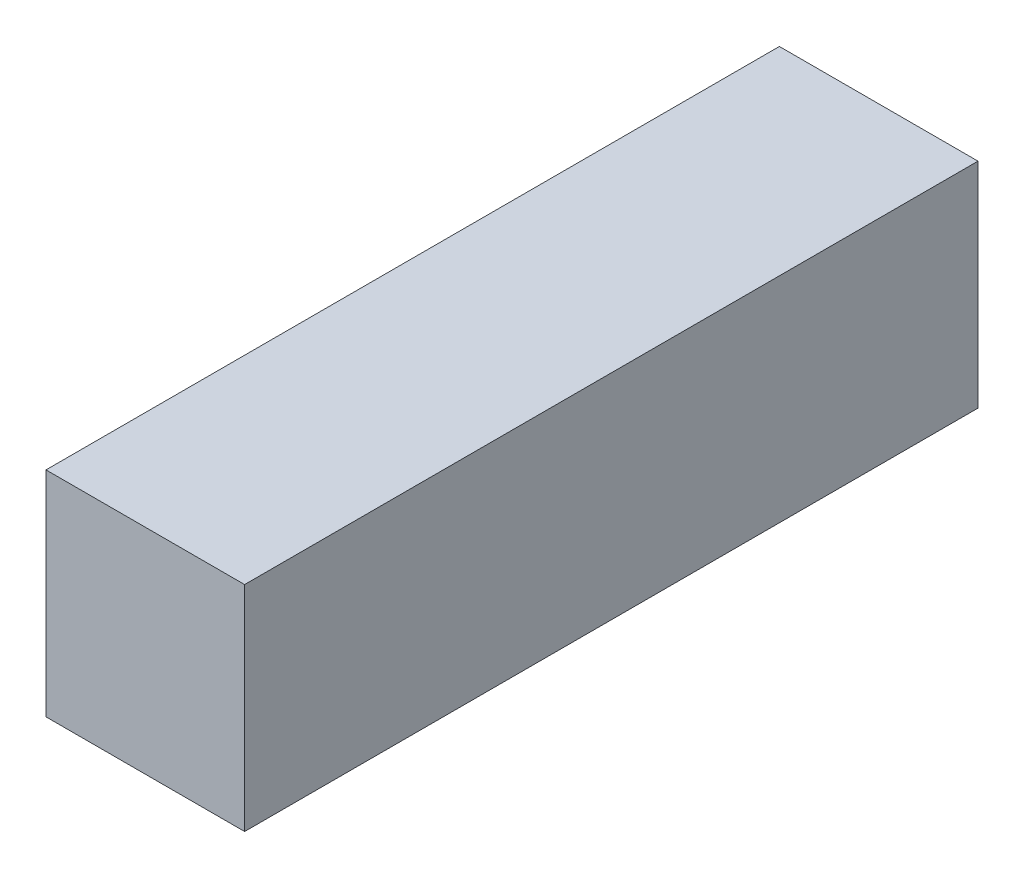
from build123d import *

# Parameters (mm, degrees)
SKETCH1_W           = 41.275
SKETCH1_H           = 44.45
BOSS_EXTRUDE1_DEPTH = 152.4


with BuildPart() as part:
    # Sketch1 → Boss-Extrude1 (new body)
    with BuildSketch(Plane.XY):
        with Locations((20.6375, 22.225)):
            Rectangle(SKETCH1_W, SKETCH1_H)
    extrude(amount=BOSS_EXTRUDE1_DEPTH)


solid = part.part
